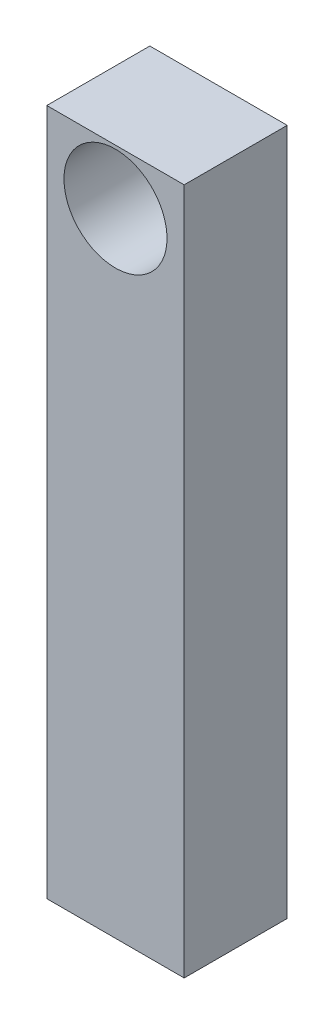
from build123d import *

# Parameters (mm, degrees)
SKETCH_1_W          = 4
SKETCH_1_H          = 20
EXTRUDE_1_DEPTH     = 3
SKETCH_2_R          = 1.5
CUT_EXTRUDE_3_DEPTH = 3


with BuildPart() as part:
    # 草圖1 → 填料-伸長1 (new body)
    with BuildSketch(Plane.XY):
        Rectangle(SKETCH_1_W, SKETCH_1_H)
    extrude(amount=EXTRUDE_1_DEPTH)

    # 草圖2 → 除料-伸長3 (cut)
    with BuildSketch(Plane(origin=(0, 0, 0), x_dir=(-1, 0, 0), z_dir=(0, 0, -1))):
        with Locations((0, 8.4)):
            Circle(SKETCH_2_R)
    extrude(amount=-CUT_EXTRUDE_3_DEPTH, mode=Mode.SUBTRACT)


solid = part.part
